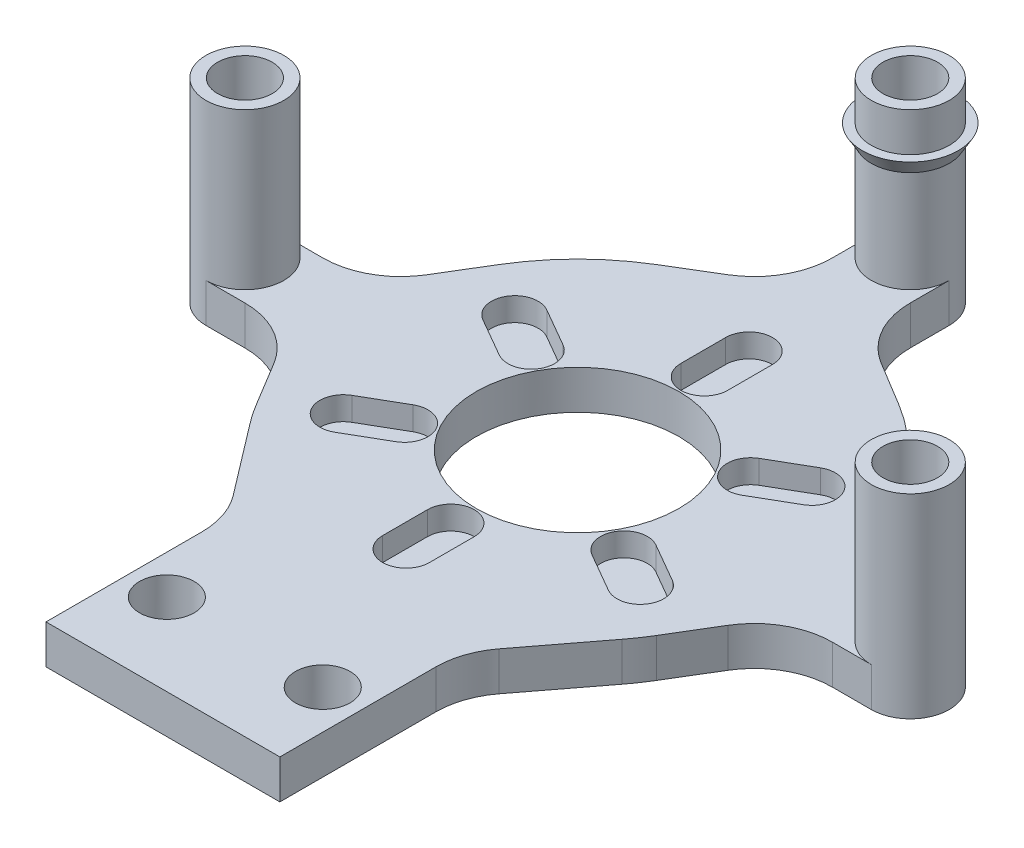
from build123d import *
from build123d.topology import SkipClean

# Parameters (mm, degrees)
ESQUISSE1_R             = 30
ESQUISSE1_R_2           = 13
BOSS_EXTRU_1_DEPTH      = 3
BOSS_EXTRU_2_START      = 2
ESQUISSE2_R             = 30
ESQUISSE2_R_2           = 13
BOSS_EXTRU_2_DEPTH      = 2
BOSS_EXTRU_3_START      = -5
ESQUISSE3_R             = 3.5
BOSS_EXTRU_3_DEPTH      = 5
ESQUISSE4_R             = 5
BOSS_EXTRU_4_DEPTH      = 20
ESQUISSE5_R             = 3.5
ENL_V_MAT_EXTRU_1_DEPTH = 76.67344349


with BuildPart() as part:
    # Esquisse1 → Boss.-Extru.1 (new body)
    with BuildSketch(Plane(origin=(0, 0, 0), x_dir=(1, 0, 0), z_dir=(0, 1, 0))):
        with Locations(Location((0, 0, 0), (0, 0, 270))):
            Circle(ESQUISSE1_R)
        with Locations(Location((0, 0, 0), (0, 0, 270))):
            Circle(ESQUISSE1_R_2, mode=Mode.SUBTRACT)
        with BuildLine():
            Line((-3, 16.25), (-3, 22))
            ThreePointArc((-3, 22), (0, 25), (3, 22))
            Line((3, 22), (3, 16.25))
            ThreePointArc((3, 16.25), (0, 13.25), (-3, 16.25))
        make_face(mode=Mode.SUBTRACT)
        with BuildLine():
            Line((12.572912811, 10.723076211), (17.552558883, 13.598076211))
            ThreePointArc((17.552558883, 13.598076211), (21.650635095, 12.5), (20.552558883, 8.401923789))
            Line((20.552558883, 8.401923789), (15.572912811, 5.526923789))
            ThreePointArc((15.572912811, 5.526923789), (11.4748366, 6.625), (12.572912811, 10.723076211))
        make_face(mode=Mode.SUBTRACT)
        with BuildLine():
            Line((15.572912811, -5.526923789), (20.552558883, -8.401923789))
            ThreePointArc((20.552558883, -8.401923789), (21.650635095, -12.5), (17.552558883, -13.598076211))
            Line((17.552558883, -13.598076211), (12.572912811, -10.723076211))
            ThreePointArc((12.572912811, -10.723076211), (11.4748366, -6.625), (15.572912811, -5.526923789))
        make_face(mode=Mode.SUBTRACT)
        with BuildLine():
            Line((3, -16.25), (3, -22))
            ThreePointArc((3, -22), (0, -25), (-3, -22))
            Line((-3, -22), (-3, -16.25))
            ThreePointArc((-3, -16.25), (0, -13.25), (3, -16.25))
        make_face(mode=Mode.SUBTRACT)
        with BuildLine():
            Line((-12.572912811, -10.723076211), (-17.552558883, -13.598076211))
            ThreePointArc((-17.552558883, -13.598076211), (-21.650635095, -12.5), (-20.552558883, -8.401923789))
            Line((-20.552558883, -8.401923789), (-15.572912811, -5.526923789))
            ThreePointArc((-15.572912811, -5.526923789), (-11.4748366, -6.625), (-12.572912811, -10.723076211))
        make_face(mode=Mode.SUBTRACT)
        with BuildLine():
            Line((-15.572912811, 5.526923789), (-20.552558883, 8.401923789))
            ThreePointArc((-20.552558883, 8.401923789), (-21.650635095, 12.5), (-17.552558883, 13.598076211))
            Line((-17.552558883, 13.598076211), (-12.572912811, 10.723076211))
            ThreePointArc((-12.572912811, 10.723076211), (-11.4748366, 6.625), (-15.572912811, 5.526923789))
        make_face(mode=Mode.SUBTRACT)
    extrude(amount=BOSS_EXTRU_1_DEPTH)

    # Esquisse2 → Boss.-Extru.2 (add)
    with BuildSketch(Plane.XZ.offset(BOSS_EXTRU_2_START)):
        with Locations(Location((0, 0, 0), (0, 0, 270))):
            Circle(ESQUISSE2_R)
        with Locations(Location((0, 0, 0), (0, 0, 270))):
            Circle(ESQUISSE2_R_2, mode=Mode.SUBTRACT)
    extrude(amount=-BOSS_EXTRU_2_DEPTH)

    # Esquisse3 → Boss.-Extru.3 (add)
    # profile 1 of 4: a face of its own
    with SkipClean():  # the faces are left unmerged after this step: merging them gives an invalid solid
        with BuildSketch(Plane(origin=(0, 3, 0), x_dir=(1, 0, 0), z_dir=(0, 1, 0)).offset(BOSS_EXTRU_3_START)):
            with BuildLine():
                Line((-15, -33.185852199), (-15, -53.185852199))
                Line((-15, -53.185852199), (15, -53.185852199))
                Line((15, -53.185852199), (15, -33.185852199))
                ThreePointArc((15, -33.185852199), (15.525518495, -29.986758544), (17.046840042, -27.123901466))
                Line((17.046840042, -27.123901466), (23.859479873, -18.185852199))
                ThreePointArc((23.859479873, -18.185852199), (0, -30), (-23.859479873, -18.185852199))
                Line((-23.859479873, -18.185852199), (-17.046840042, -27.123901466))
                ThreePointArc((-17.046840042, -27.123901466), (-15.525518495, -29.986758544), (-15, -33.185852199))
            make_face()
            with Locations(Location((-10, -42.685852199, 0), (0, 0, 270))):
                Circle(ESQUISSE3_R, mode=Mode.SUBTRACT)
            with Locations(Location((10, -42.685852199, 0), (0, 0, 270))):
                Circle(ESQUISSE3_R, mode=Mode.SUBTRACT)
        # profile 2 of 4: a face of its own
        with BuildSketch(Plane(origin=(0, 3, 0), x_dir=(1, 0, 0), z_dir=(0, 1, 0)).offset(BOSS_EXTRU_3_START)):
            with BuildLine():
                Line((37.673212347, 5), (42.673212347, 5))
                ThreePointArc((42.673212347, 5), (47.673212347, 0), (42.673212347, -5))
                Line((42.673212347, -5), (37.673212347, -5))
                ThreePointArc((37.673212347, -5), (32.760729603, -6.289804061), (29.115474898, -9.826497342))
                Line((29.115474898, -9.826497342), (25.673212347, -15.520507974))
                ThreePointArc((25.673212347, -15.520507974), (30, 0), (25.673212347, 15.520507974))
                Line((25.673212347, 15.520507974), (29.115474898, 9.826497342))
                ThreePointArc((29.115474898, 9.826497342), (32.760729603, 6.289804061), (37.673212347, 5))
            make_face()
        # profile 3 of 4: a face of its own
        with BuildSketch(Plane(origin=(0, 3, 0), x_dir=(1, 0, 0), z_dir=(0, 1, 0)).offset(BOSS_EXTRU_3_START)):
            with BuildLine():
                Line((-5, 37.673212347), (-5, 42.673212347))
                ThreePointArc((-5, 42.673212347), (0, 47.673212347), (5, 42.673212347))
                Line((5, 42.673212347), (5, 37.673212347))
                ThreePointArc((5, 37.673212347), (6.289804061, 32.760729603), (9.826497342, 29.115474898))
                Line((9.826497342, 29.115474898), (15.520507974, 25.673212347))
                ThreePointArc((15.520507974, 25.673212347), (0, 30), (-15.520507974, 25.673212347))
                Line((-15.520507974, 25.673212347), (-9.826497342, 29.115474898))
                ThreePointArc((-9.826497342, 29.115474898), (-6.289804061, 32.760729603), (-5, 37.673212347))
            make_face()
        # profile 4 of 4: a face of its own
        with BuildSketch(Plane(origin=(0, 3, 0), x_dir=(1, 0, 0), z_dir=(0, 1, 0)).offset(BOSS_EXTRU_3_START)):
            with BuildLine():
                Line((-37.673212347, -5), (-42.673212347, -5))
                ThreePointArc((-42.673212347, -5), (-47.673212347, 0), (-42.673212347, 5))
                Line((-42.673212347, 5), (-37.673212347, 5))
                ThreePointArc((-37.673212347, 5), (-32.760729603, 6.289804061), (-29.115474898, 9.826497342))
                Line((-29.115474898, 9.826497342), (-25.673212347, 15.520507974))
                ThreePointArc((-25.673212347, 15.520507974), (-30, 0), (-25.673212347, -15.520507974))
                Line((-25.673212347, -15.520507974), (-29.115474898, -9.826497342))
                ThreePointArc((-29.115474898, -9.826497342), (-32.760729603, -6.289804061), (-37.673212347, -5))
            make_face()
        extrude(amount=BOSS_EXTRU_3_DEPTH)

    # Esquisse4 → Boss.-Extru.4 (add)
    with SkipClean():  # the faces are left unmerged after this step: merging them gives an invalid solid
        with BuildSketch(Plane(origin=(0, 3, 0), x_dir=(1, 0, 0), z_dir=(0, 1, 0))):
            with Locations(Location((-42.673212347, 0, 0), (0, 0, 270))):
                Circle(ESQUISSE4_R)
            with Locations(Location((42.673212347, 0, 0), (0, 0, 270))):
                Circle(ESQUISSE4_R)
            with Locations(Location((0, 42.673212347, 0), (0, 0, 270))):
                Circle(ESQUISSE4_R)
        extrude(amount=BOSS_EXTRU_4_DEPTH)

    # Esquisse5 → Enlèv. mat.-Extru.1 (cut, through all)
    with SkipClean():  # the faces are left unmerged after this step: merging them gives an invalid solid
        with BuildSketch(Plane(origin=(0, 23, 0), x_dir=(1, 0, 0), z_dir=(0, 1, 0))):
            with Locations(Location((-42.673212347, 0, 0), (0, 0, 270))):
                Circle(ESQUISSE5_R)
            with Locations(Location((42.673212347, 0, 0), (0, 0, 270))):
                Circle(ESQUISSE5_R)
            with Locations(Location((0, 42.673212347, 0), (0, 0, 270))):
                Circle(ESQUISSE5_R)
        extrude(amount=-ENL_V_MAT_EXTRU_1_DEPTH, mode=Mode.SUBTRACT)

    # Esquisse6 → Révolution1 (revolve)
    with SkipClean():  # the faces are left unmerged after this step: merging them gives an invalid solid
        with BuildSketch(Plane.XY.offset(-42.673212347), mode=Mode.PRIVATE) as r_volution1_sk:
            Polygon((5, 16), (6.154700538, 18), (5, 18), align=None)
        revolve(r_volution1_sk.sketch.rotate(Axis((0, -2, -42.673212347), (0, 1, 0)), 270), axis=Axis((0, -2, -42.673212347), (0, 1, 0)))


solid = part.part
